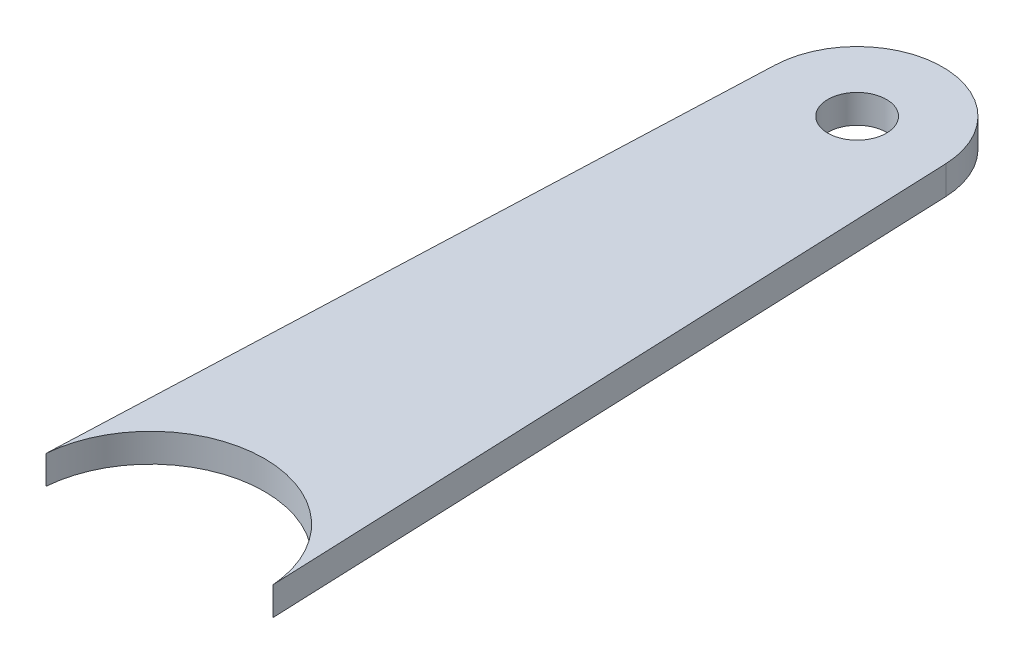
from build123d import *

# Parameters (mm, degrees)
SKETCH1_R           = 3.2639
BOSS_EXTRUDE2_DEPTH = 3.175


with BuildPart() as part:
    # Sketch1 → Boss-Extrude2 (new body)
    with BuildSketch(Plane(origin=(0, 0, 0), x_dir=(1, 0, 0), z_dir=(0, 1, 0))):
        with BuildLine():
            Line((3.182693573, 79.1379976), (0.041015819, 1.019862499))
            ThreePointArc((0.041015819, 1.019862499), (12.7, 12.7), (25.358984181, 1.019862499))
            Line((25.358984181, 1.019862499), (22.217306427, 79.1379976))
            ThreePointArc((22.217306427, 79.1379976), (12.7, 88.28024), (3.182693573, 79.1379976))
        make_face()
        with Locations(Location((12.7, 78.75524, 0), (0, 0, 270))):
            Circle(SKETCH1_R, mode=Mode.SUBTRACT)
    extrude(amount=BOSS_EXTRUDE2_DEPTH)


solid = part.part
